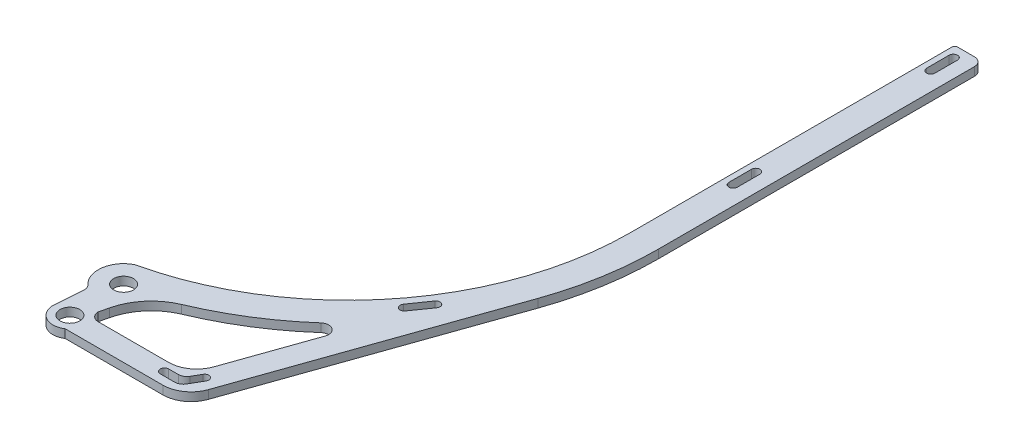
from build123d import *

# Parameters (mm, degrees)
SKETCH_2_R          = 1.5
EXTRUDE_1_DEPTH     = 3
EXTRUDE_START       = -3
EXTRUDE_2_DEPTH     = 3
FILLET_3_R          = 3
FILLET_4_R          = 10
FILLET_5_R          = 3
CUT_EXTRUDE_1_DEPTH = 9.5
FILLET_6_R          = 3
CUT_EXTRUDE_2_DEPTH = 256.693293577
CUT_EXTRUDE_3_DEPTH = 256.693293577
SKETCH_7_W          = 10
SKETCH_7_H          = 2
CUT_EXTRUDE_4_DEPTH = 256.693293577
FILLET_9_R          = 1
FILLET_10_R         = 3
SKETCH_8_R          = 6
EXTRUDE_3_DEPTH     = 3
SKETCH_9_R          = 3.5
CUT_EXTRUDE_5_DEPTH = 3
SKETCH_10_R         = 3.5
CUT_EXTRUDE_6_DEPTH = 3
EXTRUDE_6_DEPTH     = 3
EXTRUDE_7_DEPTH     = 3
EXTRUDE_8_DEPTH     = 3
FILLET_12_R         = 3
FILLET_13_R         = 20


with BuildPart() as part:
    # 草图2 → 凸台-拉伸1 (new body)
    # profile 1 of 3: a face of its own
    with BuildSketch(Plane(origin=(0, 0, 0), x_dir=(1, 0, 0), z_dir=(0, 1, 0))):
        with BuildLine():
            Line((-4, 27), (-4, 23))
            Line((-4, 23), (-4, 3))
            ThreePointArc((-4, 3), (0, 5), (4, 3))
            Line((4, 3), (4, 18.72063168))
            ThreePointArc((4, 18.72063168), (61.714912944, 58.202422296), (83.951238111, 124.5))
            Line((83.951238111, 124.5), (83.951238111, 241.5))
            Line((83.951238111, 241.5), (73.951238111, 241.5))
            Line((73.951238111, 241.5), (73.951238111, 124.5))
            ThreePointArc((73.951238111, 124.5), (52.067846257, 62.084766437), (-4, 27))
        make_face()
        with Locations(Location((0, 19, 0), (0, 0, 270))):
            Circle(SKETCH_2_R, mode=Mode.SUBTRACT)
    # profile 2 of 3: a face of its own
    with BuildSketch(Plane(origin=(0, 0, 0), x_dir=(1, 0, 0), z_dir=(0, 1, 0))):
        with BuildLine():
            ThreePointArc((4, 3), (0, 5), (-4, 3))
            Line((-4, 3), (-4, 0))
            Line((-4, 0), (-1.5, 0))
            ThreePointArc((-1.5, 0), (0, 1.5), (1.5, 0))
            Line((1.5, 0), (4, 0))
            Line((4, 0), (4, 3))
        make_face()
    # profile 3 of 3: a face of its own
    with BuildSketch(Plane(origin=(0, 0, 0), x_dir=(1, 0, 0), z_dir=(0, 1, 0))):
        with BuildLine():
            Line((-4, 0), (-4, 3))
            ThreePointArc((-4, 3), (-1.58113883, -4.74341649), (5, 0))
            ThreePointArc((5, 0), (4.74341649, 1.58113883), (4, 3))
            Line((4, 3), (4, 0))
            Line((4, 0), (1.5, 0))
            ThreePointArc((1.5, 0), (0, -1.5), (-1.5, 0))
            Line((-1.5, 0), (-4, 0))
        make_face()
    extrude(amount=EXTRUDE_1_DEPTH)

    # 草图3 → 凸台-拉伸2 (add)
    with BuildSketch(Plane(origin=(0, 3, 0), x_dir=(1, 0, 0), z_dir=(0, 1, 0)).offset(EXTRUDE_START)):
        with BuildLine():
            ThreePointArc((4, 3), (4.472135955, -2.236067977), (0, -5))
            Line((0, -5), (45, -5))
            Line((45, -5), (77.720510398, 88.012598271))
            ThreePointArc((77.720510398, 88.012598271), (68.645690453, 68.540478551), (55.957710685, 51.204649386))
            Line((55.957710685, 51.204649386), (39, 3))
            Line((39, 3), (4, 3))
        make_face()
    extrude(amount=EXTRUDE_2_DEPTH)

    # 圆角3
    fillet_3_edges = [part.edges().sort_by_distance(p)[0] for p in [
        (55.957710685, 1.5, -51.204649386),
    ]]
    fillet(fillet_3_edges, radius=FILLET_3_R)

    # 圆角4
    fillet_4_edges = [part.edges().sort_by_distance(p)[0] for p in [
        (39, 1.5, -3),
        (45, 1.5, 5),
    ]]
    fillet(fillet_4_edges, radius=FILLET_4_R)

    # 圆角5
    fillet_5_edges = [part.edges().sort_by_distance(p)[0] for p in [
        (4, 1.5, -3),
        (-4, 1.5, -3),
    ]]
    fillet(fillet_5_edges, radius=FILLET_5_R)

    # 草图4 → 切除-拉伸1 (cut)
    with BuildSketch(Plane(origin=(0, 3, 0), x_dir=(1, 0, 0), z_dir=(0, 1, 0))):
        with BuildLine():
            Line((40.866025404, -2), (44.299038106, 3.946152423))
            ThreePointArc((44.299038106, 3.946152423), (43.75, 5.995190528), (41.700961894, 5.446152423))
            Line((41.700961894, 5.446152423), (39.133974596, 1))
            Line((39.133974596, 1), (34, 1))
            ThreePointArc((34, 1), (32.5, -0.5), (34, -2))
            Line((34, -2), (40.866025404, -2))
        make_face()
    extrude(amount=-CUT_EXTRUDE_1_DEPTH, mode=Mode.SUBTRACT)

    # 圆角6
    fillet_6_edges = [part.edges().sort_by_distance(p)[0] for p in [
        (40.866025404, 1.5, 2),
        (39.133974596, 1.5, -1),
    ]]
    fillet(fillet_6_edges, radius=FILLET_6_R)

    # 草图5 → 切除-拉伸2 (cut, through all)
    with BuildSketch(Plane(origin=(0, 3, 0), x_dir=(1, 0, 0), z_dir=(0, 1, 0))):
        with BuildLine():
            Line((62.714846418, 67.264294142), (58.126234927, 60.711077788))
            ThreePointArc((58.126234927, 60.711077788), (56.037142206, 60.342714376), (55.668778794, 62.431807097))
            Line((55.668778794, 62.431807097), (60.257390285, 68.985023451))
            ThreePointArc((60.257390285, 68.985023451), (62.346483006, 69.353386863), (62.714846418, 67.264294142))
        make_face()
    extrude(amount=-CUT_EXTRUDE_2_DEPTH, mode=Mode.SUBTRACT)

    # 草图6 → 切除-拉伸3 (cut, through all)
    with BuildSketch(Plane(origin=(0, 3, 0), x_dir=(1, 0, 0), z_dir=(0, 1, 0))):
        with BuildLine():
            Line((78.951238111, 235.5), (78.951238111, 227.5))
            ThreePointArc((78.951238111, 227.5), (77.451238111, 226), (75.951238111, 227.5))
            Line((75.951238111, 227.5), (75.951238111, 235.5))
            ThreePointArc((75.951238111, 235.5), (77.451238111, 237), (78.951238111, 235.5))
        make_face()
        with BuildLine():
            Line((75.951238111, 165.5), (75.951238111, 157.5))
            ThreePointArc((75.951238111, 157.5), (77.451238111, 156), (78.951238111, 157.5))
            Line((78.951238111, 157.5), (78.951238111, 165.5))
            ThreePointArc((78.951238111, 165.5), (77.451238111, 167), (75.951238111, 165.5))
        make_face()
    extrude(amount=-CUT_EXTRUDE_3_DEPTH, mode=Mode.SUBTRACT)

    # 草图7 → 切除-拉伸4 (cut, through all)
    with BuildSketch(Plane(origin=(0, 3, 0), x_dir=(1, 0, 0), z_dir=(0, 1, 0))):
        with Locations((78.951238111, 240.5)):
            Rectangle(SKETCH_7_W, SKETCH_7_H)
    extrude(amount=-CUT_EXTRUDE_4_DEPTH, mode=Mode.SUBTRACT)

    # 圆角9
    fillet_9_edges = [part.edges().sort_by_distance(p)[0] for p in [
        (73.951238111, 1.5, -239.5),
    ]]
    fillet(fillet_9_edges, radius=FILLET_9_R)

    # 圆角10
    fillet_10_edges = [part.edges().sort_by_distance(p)[0] for p in [
        (83.951238111, 1.5, -239.5),
    ]]
    fillet(fillet_10_edges, radius=FILLET_10_R)

    # 草图8 → 凸台-拉伸3 (add)
    with BuildSketch(Plane(origin=(0, 3, 0), x_dir=(1, 0, 0), z_dir=(0, 1, 0))):
        Circle(SKETCH_8_R)
    extrude(amount=-EXTRUDE_3_DEPTH)

    # 草图9 → 切除-拉伸5 (cut)
    with BuildSketch(Plane(origin=(0, 3, 0), x_dir=(1, 0, 0), z_dir=(0, 1, 0))):
        with Locations(Location((0, 0, 0), (0, 0, 270))):
            Circle(SKETCH_9_R)
    extrude(amount=-CUT_EXTRUDE_5_DEPTH, mode=Mode.SUBTRACT)

    # 草图10 → 切除-拉伸6 (cut)
    with BuildSketch(Plane(origin=(0, 3, 0), x_dir=(1, 0, 0), z_dir=(0, 1, 0))):
        with Locations(Location((0, 19, 0), (0, 0, 270))):
            Circle(SKETCH_10_R)
    extrude(amount=-CUT_EXTRUDE_6_DEPTH, mode=Mode.SUBTRACT)

    # 草图12 → 凸台-拉伸6 (add)
    with BuildSketch(Plane(origin=(0, 3, 0), x_dir=(1, 0, 0), z_dir=(0, 1, 0))):
        Polygon((4, 6), (4, 18.72063168), (7.464101615, 20.72063168), align=None)
    extrude(amount=-EXTRUDE_6_DEPTH)

    # 草图14 → 凸台-拉伸7 (add)
    with BuildSketch(Plane(origin=(0, 3, 0), x_dir=(1, 0, 0), z_dir=(0, 1, 0))):
        Polygon((-4, 27), (-6, 0), (-4, 4.472135955), align=None)
    extrude(amount=-EXTRUDE_7_DEPTH)

    # 草图15 → 凸台-拉伸8 (add)
    with BuildSketch(Plane(origin=(0, 3, 0), x_dir=(1, 0, 0), z_dir=(0, 1, 0))):
        with BuildLine():
            Line((-5.135061392, 11.676671214), (-4, 27))
            ThreePointArc((-4, 27), (-8.919833963, 19.660728442), (-5.135061392, 11.676671214))
        make_face()
    extrude(amount=-EXTRUDE_8_DEPTH)

    # 圆角12
    fillet_12_edges = [part.edges().sort_by_distance(p)[0] for p in [
        (-4, 1.5, -27),
        (-5.135061392, 1.5, -11.676671214),
    ]]
    fillet(fillet_12_edges, radius=FILLET_12_R)

    # 圆角13
    fillet_13_edges = [part.edges().sort_by_distance(p)[0] for p in [
        (7.221005183, 1.5, -19.687598172),
    ]]
    fillet(fillet_13_edges, radius=FILLET_13_R)


solid = part.part
